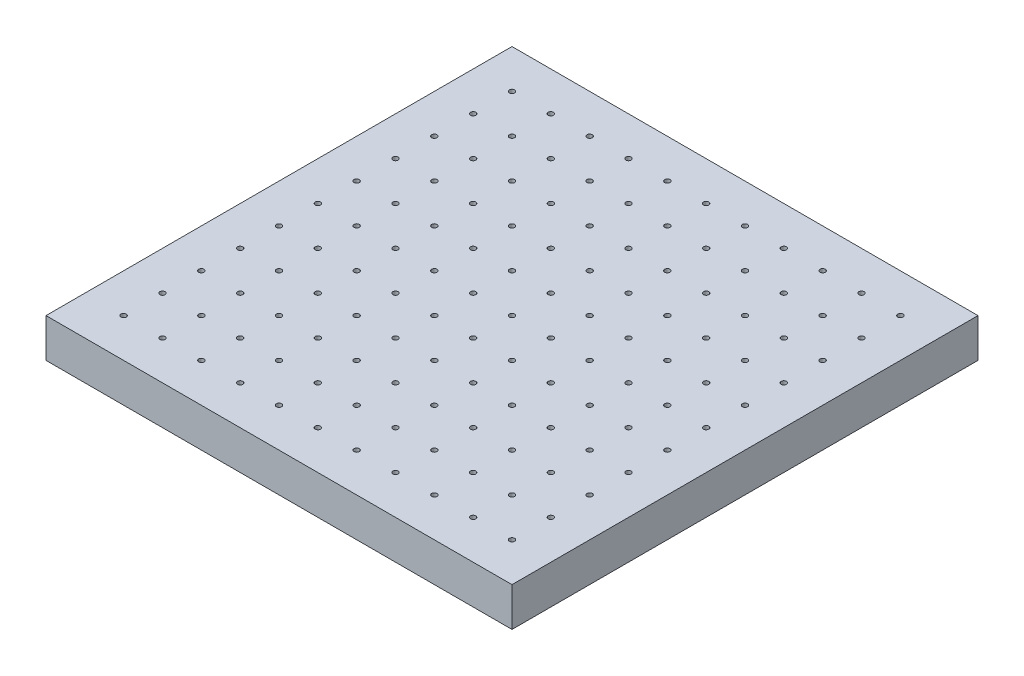
from build123d import *

# Parameters (mm, degrees)
SKETCH2_W                 = 304.8
SKETCH2_H                 = 304.8
BOSS_EXTRUDE1_DEPTH       = 25.4
F_8_32_TAPPED_HOLE1_D     = 3.4544
F_8_32_TAPPED_HOLE1_DEPTH = 10.668
F_8_32_TAPPED_HOLE1_TIP   = 1.037806461


with BuildPart() as part:
    # Sketch2 → Boss-Extrude1 (new body)
    with BuildSketch(Plane(origin=(0, 0, 0), x_dir=(1, 0, 0), z_dir=(0, 1, 0))):
        with Locations((152.4, 152.4)):
            Rectangle(SKETCH2_W, SKETCH2_H)
    extrude(amount=BOSS_EXTRUDE1_DEPTH)

    # #8-32 Tapped Hole1
    with Locations(Plane(origin=(0, 25.4, 0), x_dir=(1, 0, 0), z_dir=(0, 1, 0))):
        with Locations((25.4, 25.4), (50.8, 25.4), (76.2, 25.4), (101.6, 25.4), (127, 25.4), (152.4, 25.4), (177.8, 25.4), (203.2, 25.4), (228.6, 25.4), (254, 25.4), (279.4, 25.4), (50.8, 50.8), (76.2, 50.8), (101.6, 50.8), (127, 50.8), (152.4, 50.8), (177.8, 50.8), (203.2, 50.8), (228.6, 50.8), (254, 50.8), (279.4, 50.8), (50.8, 76.2), (76.2, 76.2), (101.6, 76.2), (127, 76.2), (152.4, 76.2), (177.8, 76.2), (203.2, 76.2), (228.6, 76.2), (254, 76.2), (279.4, 76.2), (50.8, 101.6), (76.2, 101.6), (101.6, 101.6), (127, 101.6), (152.4, 101.6), (177.8, 101.6), (203.2, 101.6), (228.6, 101.6), (254, 101.6), (279.4, 101.6), (50.8, 127), (76.2, 127), (101.6, 127), (127, 127), (152.4, 127), (177.8, 127), (203.2, 127), (228.6, 127), (254, 127), (279.4, 127), (50.8, 152.4), (76.2, 152.4), (101.6, 152.4), (127, 152.4), (152.4, 152.4), (177.8, 152.4), (203.2, 152.4), (228.6, 152.4), (254, 152.4), (279.4, 152.4), (50.8, 177.8), (76.2, 177.8), (101.6, 177.8), (127, 177.8), (152.4, 177.8), (177.8, 177.8), (203.2, 177.8), (228.6, 177.8), (254, 177.8), (279.4, 177.8), (50.8, 203.2), (76.2, 203.2), (101.6, 203.2), (127, 203.2), (152.4, 203.2), (177.8, 203.2), (203.2, 203.2), (228.6, 203.2), (254, 203.2), (279.4, 203.2), (50.8, 228.6), (76.2, 228.6), (101.6, 228.6), (127, 228.6), (152.4, 228.6), (177.8, 228.6), (203.2, 228.6), (228.6, 228.6), (254, 228.6), (279.4, 228.6), (50.8, 254), (76.2, 254), (101.6, 254), (127, 254), (152.4, 254), (177.8, 254), (203.2, 254), (228.6, 254), (254, 254), (279.4, 254), (50.8, 279.4), (76.2, 279.4), (101.6, 279.4), (127, 279.4), (152.4, 279.4), (177.8, 279.4), (203.2, 279.4), (228.6, 279.4), (254, 279.4), (279.4, 279.4), (25.4, 50.8), (25.4, 76.2), (25.4, 101.6), (25.4, 127), (25.4, 152.4), (25.4, 177.8), (25.4, 203.2), (25.4, 228.6), (25.4, 254), (25.4, 279.4)):
            Hole(F_8_32_TAPPED_HOLE1_D / 2, depth=F_8_32_TAPPED_HOLE1_DEPTH)
            with Locations((0, 0, -(F_8_32_TAPPED_HOLE1_DEPTH + F_8_32_TAPPED_HOLE1_TIP / 2))):  # 118° drill point
                Cone(0, F_8_32_TAPPED_HOLE1_D / 2, F_8_32_TAPPED_HOLE1_TIP, mode=Mode.SUBTRACT)


solid = part.part
